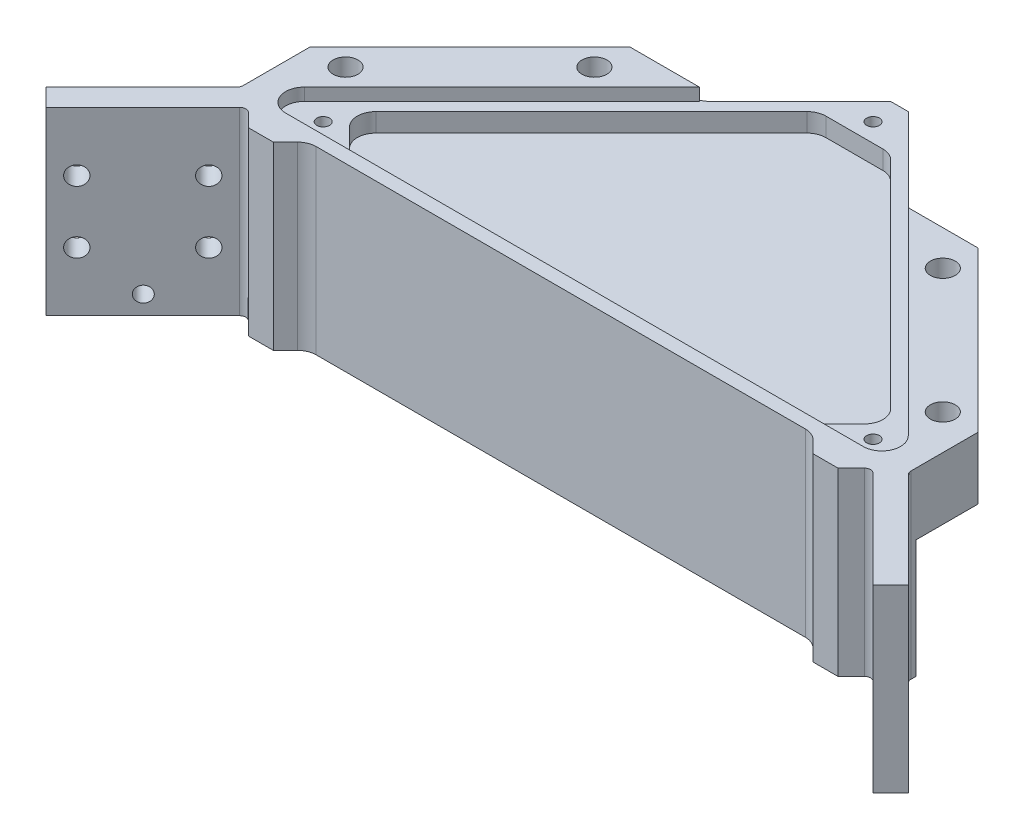
from build123d import *

# Parameters (mm, degrees)
SKETCH_1_R                   = 2
SKETCH_1_R_2                 = 1
EXTRUDE_1_DEPTH              = 29
CUT_EXTRUDE_1_DEPTH          = 5
CUT_EXTRUDE_START            = -10
CUT_EXTRUDE_2_DEPTH          = 19
CUT_EXTRUDE_3_DEPTH          = 2
SKETCH_11_R                  = 1.5
CUT_EXTRUDE_4_DEPTH          = 104.437531222
SKETCH_13_R                  = 1.25
CUT_EXTRUDE_5_DEPTH          = 2
HOLE_WIZARD_M2_5_6_D         = 2.05
HOLE_WIZARD_M3_1_D           = 2.5
HOLE_WIZARD_M3_1_CSINK_D     = 3.05
HOLE_WIZARD_M3_1_CSINK_ANGLE = 90
CHAMFER_1_SIZE               = 2
FILLET_1_R                   = 3
FILLET_2_R                   = 1


with BuildPart() as part:
    # 草图1 → 凸台-拉伸1 (new body)
    # profile 1 of 2: a face of its own
    with BuildSketch(Plane(origin=(0, 0, 0), x_dir=(1, 0, 0), z_dir=(0, 1, 0))):
        Polygon((69.296464556, -30.626082539), (66.468037432, -33.454509664), (50.204581464, -17.191053697), (47.376154339, -20.019480821), (43.376154339, -20.019480821), (40.547727215, -17.191053697), (2.052219297, -17.191053697), (-40.547727215, -17.191053697), (-43.376154339, -20.019480821), (-47.376154339, -20.019480821), (-50.204581464, -17.191053697), (-66.468037432, -33.454509664), (-69.296464556, -30.626082539), (-53.656854249, -14.986472232), (-53.656854249, -3.776840134), (-28, 21.880014115), (-16.790367902, 21.880014115), (0, 38.670382017), (16.790367902, 21.880014115), (28, 21.880014115), (53.656854249, -3.776840134), (53.656854249, -14.986472232), align=None)
        with Locations(Location((28, 16.223159866, 0), (0, 0, 270))):
            Circle(SKETCH_1_R, mode=Mode.SUBTRACT)
        with Locations(Location((-28, 16.223159866, 0), (0, 0, 270))):
            Circle(SKETCH_1_R, mode=Mode.SUBTRACT)
        with Locations(Location((-48, -3.776840134, 0), (0, 0, 270))):
            Circle(SKETCH_1_R, mode=Mode.SUBTRACT)
        with Locations((44.194173824, -11.180646057)):
            Circle(SKETCH_1_R_2, mode=Mode.SUBTRACT)
        with Locations((-44.194173824, -11.180646057)):
            Circle(SKETCH_1_R_2, mode=Mode.SUBTRACT)
        with Locations((0, 33.013527768)):
            Circle(SKETCH_1_R_2, mode=Mode.SUBTRACT)
        with Locations(Location((48, -3.776840134, 0), (0, 0, 270))):
            Circle(SKETCH_1_R, mode=Mode.SUBTRACT)
        Polygon((-43.487067043, -7.645112151), (-37.355339059, -13.776840134), (37.355339059, -13.776840134), (43.487067043, -7.645112151), (5.828427125, 30.013527768), (-5.828427125, 30.013527768), align=None, mode=Mode.SUBTRACT)
    # profile 2 of 2: a face of its own
    with BuildSketch(Plane(origin=(0, 0, 0), x_dir=(1, 0, 0), z_dir=(0, 1, 0))):
        Polygon((-5.828427125, 30.013527768), (-43.487067043, -7.645112151), (-37.355339059, -13.776840134), (37.355339059, -13.776840134), (43.487067043, -7.645112151), (5.828427125, 30.013527768), align=None)
    extrude(amount=-EXTRUDE_1_DEPTH)

    # 草图1<3> → 切除-拉伸1 (cut)
    with BuildSketch(Plane(origin=(0, 0, 0), x_dir=(1, 0, 0), z_dir=(0, 1, 0))):
        Polygon((-5.828427125, 30.013527768), (-43.487067043, -7.645112151), (-37.355339059, -13.776840134), (37.355339059, -13.776840134), (43.487067043, -7.645112151), (5.828427125, 30.013527768), align=None)
    extrude(amount=-CUT_EXTRUDE_1_DEPTH, mode=Mode.SUBTRACT)

    # 草图3 → 切除-拉伸2 (cut)
    with BuildSketch(Plane(origin=(0, 0, 0), x_dir=(1, 0, 0), z_dir=(0, 1, 0)).offset(CUT_EXTRUDE_START)):
        Polygon((-74.127206293, -13.776840134), (70.632375227, -13.776840134), (4.598461929, 56.317971506), align=None)
    extrude(amount=-CUT_EXTRUDE_2_DEPTH, mode=Mode.SUBTRACT)

    # 草图4 → 切除-拉伸3 (cut)
    with BuildSketch(Plane(origin=(0, 0, 0), x_dir=(1, 0, 0), z_dir=(0, 1, 0))):
        with BuildLine():
            Line((-2.121320344, 36.549061673), (-48.535533906, -9.865151889))
            ThreePointArc((-48.535533906, -9.865151889), (-49.18585216, -13.13452253), (-46.414213562, -14.986472232))
            Line((-46.414213562, -14.986472232), (46.414213562, -14.986472232))
            ThreePointArc((46.414213562, -14.986472232), (49.18585216, -13.13452253), (48.535533906, -9.865151889))
            Line((48.535533906, -9.865151889), (0, 38.670382017))
            Line((0, 38.670382017), (-2.121320344, 36.549061673))
        make_face()
    extrude(amount=-CUT_EXTRUDE_3_DEPTH, mode=Mode.SUBTRACT)

    # 草图11 → 切除-拉伸4 (cut, through all)
    with BuildSketch(Plane(origin=(-16.506763884, 0, -16.506763884), x_dir=(0.7071067811865477, 0, -0.7071067811865474), z_dir=(0.7071067811865474, 0, 0.7071067811865477))):
        with Locations((-52.155910645, -9.5)):
            Circle(SKETCH_11_R)
        with Locations((-52.155910645, -19.5)):
            Circle(SKETCH_11_R)
        with Locations((-67.155910645, -19.5)):
            Circle(SKETCH_11_R)
        with Locations((-67.155910645, -9.5)):
            Circle(SKETCH_11_R)
    cut_extrude_4 = extrude(amount=-CUT_EXTRUDE_4_DEPTH, mode=Mode.SUBTRACT)

    # 草图13 → 切除-拉伸5 (cut)
    with BuildSketch(Plane(origin=(-19.335191009, 0, -19.335191009), x_dir=(-0.7071067811865488, 0, 0.7071067811865462), z_dir=(-0.7071067811865462, 0, -0.7071067811865488))):
        with Locations((59.597036142, -26)):
            Circle(SKETCH_13_R)
    cut_extrude_5 = extrude(amount=-CUT_EXTRUDE_5_DEPTH, mode=Mode.SUBTRACT)

    # M2.5 螺纹孔6 (through all)
    with Locations(Plane(origin=(0, -2, -33.013527768), x_dir=(0, 0, 1), z_dir=(0, 1, 0))):
        with Locations((0, 0), (44.194173825, -44.194173824), (44.194173825, 44.194173824)):
            Hole(HOLE_WIZARD_M2_5_6_D / 2)

    # M3 螺纹孔1 (through all)
    with Locations(Plane(origin=(-61.476659403, -26, 22.806277386), x_dir=(-0.707106781187, 0, 0.707106781187), z_dir=(-0.707106781187, 0, -0.707106781187))):
        with Locations((0, 0)):
            hole_wizard_m3_1 = CounterSinkHole(HOLE_WIZARD_M3_1_D / 2, HOLE_WIZARD_M3_1_CSINK_D / 2, counter_sink_angle=HOLE_WIZARD_M3_1_CSINK_ANGLE)

    # 镜向2: 切除-拉伸4, 切除-拉伸5, M3 螺纹孔1 across plane
    add(cut_extrude_4.mirror(Plane.ZY), mode=Mode.SUBTRACT)
    add(cut_extrude_5.mirror(Plane.ZY), mode=Mode.SUBTRACT)
    add(hole_wizard_m3_1.mirror(Plane.ZY), mode=Mode.SUBTRACT)

    # 倒角1
    chamfer_1_edges = [part.edges().sort_by_distance(p)[0] for p in [
        (0, -6, -38.670382017),
    ]]
    chamfer(chamfer_1_edges, length=CHAMFER_1_SIZE)

    # 圆角1
    fillet_1_edges = [part.edges().sort_by_distance(p)[0] for p in [
        (-16.790367902, -6, -21.880014115),
        (16.790367902, -6, -21.880014115),
        (-43.487067043, -3.5, 7.645112151),
        (-5.828427125, -3.5, -30.013527768),
        (-37.355339059, -3.5, 13.776840134),
        (5.828427125, -3.5, -30.013527768),
        (37.355339059, -3.5, 13.776840134),
        (43.487067043, -3.5, 7.645112151),
        (-40.547727215, -14.5, 17.191053697),
        (40.547727215, -14.5, 17.191053697),
    ]]
    fillet(fillet_1_edges, radius=FILLET_1_R)

    # 圆角2
    fillet_2_edges = [part.edges().sort_by_distance(p)[0] for p in [
        (-53.656854249, -14.5, 14.986472232),
        (53.656854249, -14.5, 14.986472232),
        (-50.204581464, -14.5, 17.191053697),
        (50.204581464, -14.5, 17.191053697),
    ]]
    fillet(fillet_2_edges, radius=FILLET_2_R)


solid = part.part
